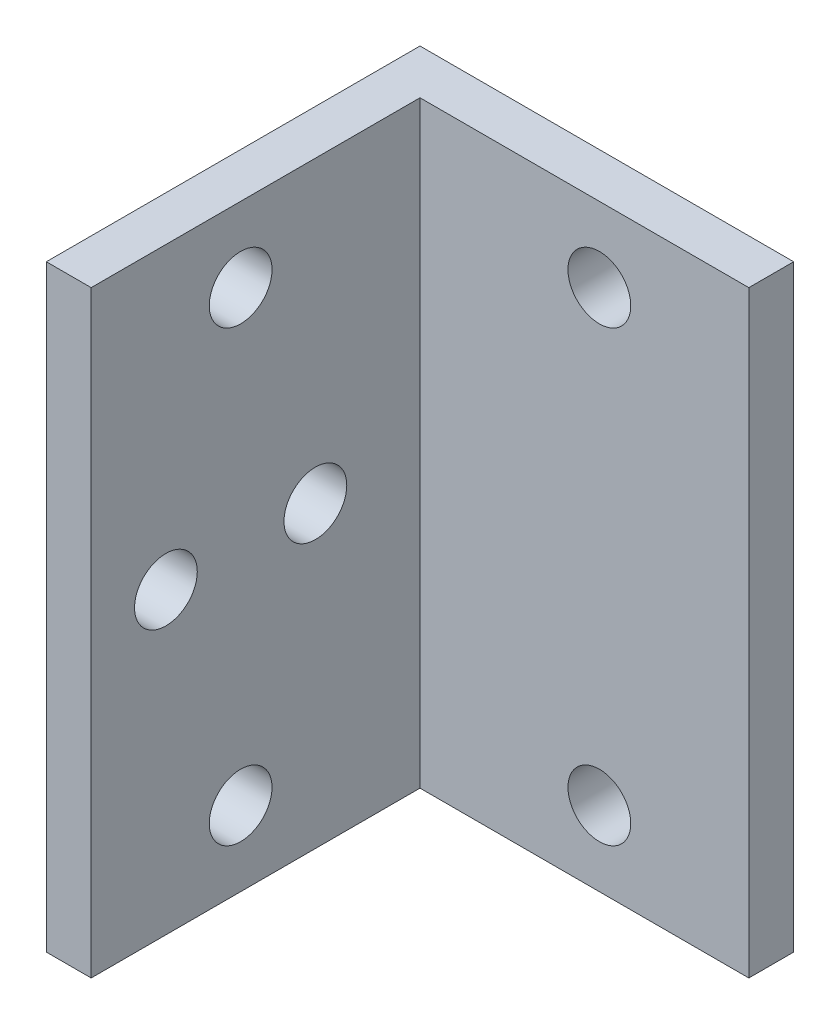
from build123d import *

# Parameters (mm, degrees)
SKETCH_1_W                  = 25
SKETCH_1_H                  = 40
EXTRUDE_1_DEPTH             = 25
SKETCH_2_W                  = 22
SKETCH_2_H                  = 22
CUT_EXTRUDE_1_DEPTH         = 74.239333694
HOLE_WIZARD_4_2_4_2_1_D     = 4.2
HOLE_WIZARD_4_2_4_2_1_DEPTH = 25
HOLE_WIZARD_4_2_4_2_2_D     = 4.2


with BuildPart() as part:
    # 草图1 → 凸台-拉伸1 (new body)
    with BuildSketch(Plane.XY.offset(20)):
        with Locations((45.5, 200)):
            Rectangle(SKETCH_1_W, SKETCH_1_H)
    extrude(amount=-EXTRUDE_1_DEPTH)

    # 草图2 → 切除-拉伸1 (cut, through all)
    with BuildSketch(Plane(origin=(0, 220, 0), x_dir=(-1, 0, 0), z_dir=(0, 1, 0))):
        with Locations((-47, 9)):
            Rectangle(SKETCH_2_W, SKETCH_2_H)
    extrude(amount=-CUT_EXTRUDE_1_DEPTH, mode=Mode.SUBTRACT)

    # Ø4.2 (4.2) 直径孔1
    with Locations(Plane(origin=(0, 0, -5), x_dir=(-1, 0, 0), z_dir=(0, 0, -1))):
        with Locations((-48, 185), (-48, 215)):
            Hole(HOLE_WIZARD_4_2_4_2_1_D / 2, depth=HOLE_WIZARD_4_2_4_2_1_DEPTH)

    # Ø4.2 (4.2) 直径孔2 (through all)
    with Locations(Plane(origin=(36, 0, 0), x_dir=(0, 0, -1), z_dir=(1, 0, 0))):
        with Locations((-10, 185), (-10, 215), (-5, 200), (-15, 200)):
            Hole(HOLE_WIZARD_4_2_4_2_2_D / 2)


solid = part.part
